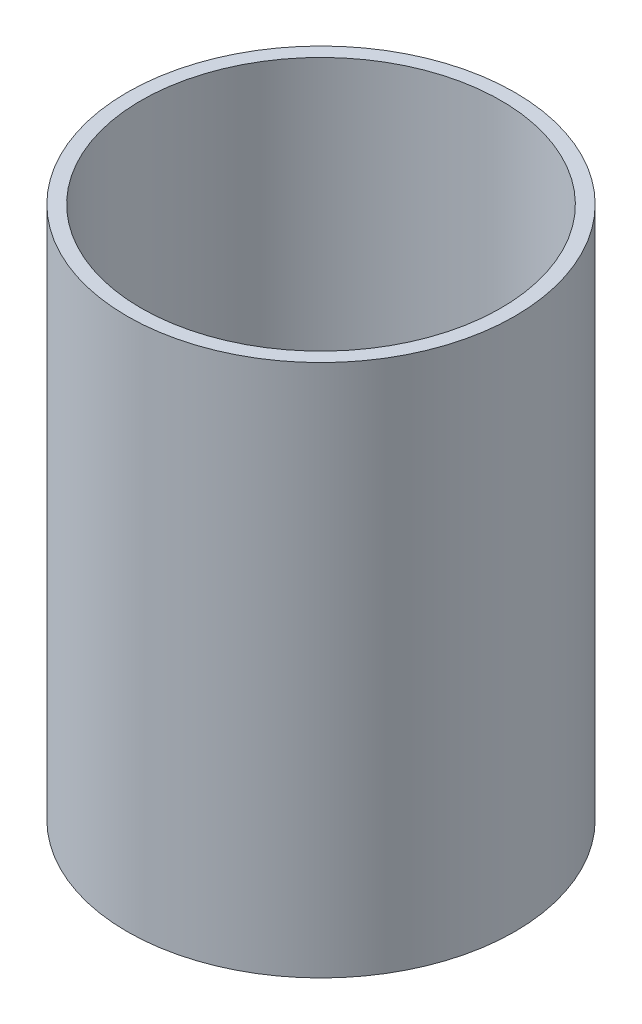
from build123d import *

# Parameters (mm, degrees)
SKETCH_6_R       = 72.75
SKETCH_6_R_2     = 67.5
EXTRUDE_12_DEPTH = 200
SKETCH_6_12_R    = 67.5
EXTRUDE_13_DEPTH = 2


with BuildPart() as part:
    # 草圖6 → 填料-伸長12 (new body)
    with BuildSketch(Plane(origin=(0, 0, 0), x_dir=(1, 0, 0), z_dir=(0, 1, 0))):
        Circle(SKETCH_6_R)
        Circle(SKETCH_6_R_2, mode=Mode.SUBTRACT)
    extrude(amount=EXTRUDE_12_DEPTH)

    # 草圖6<12> → 填料-伸長13 (add)
    with BuildSketch(Plane(origin=(0, 0, 0), x_dir=(1, 0, 0), z_dir=(0, 1, 0))):
        Circle(SKETCH_6_12_R)
    extrude(amount=EXTRUDE_13_DEPTH)


solid = part.part
